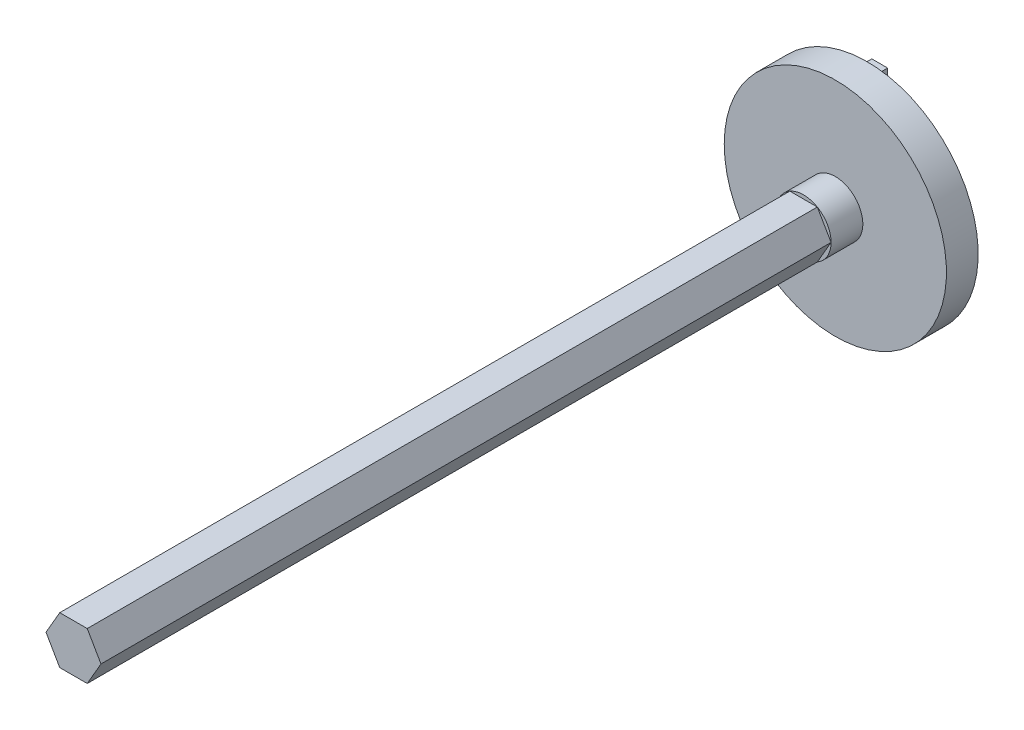
from build123d import *

# Parameters (mm, degrees)
BOSS_EXTRUDE1_DEPTH = 304.8
SKETCH2_R           = 10.998522628
BOSS_EXTRUDE2_DEPTH = 12.7
SKETCH3_R           = 44.45
BOSS_EXTRUDE3_DEPTH = 12.7
SKETCH4_W           = 6.35
SKETCH4_H           = 6.35
BOSS_EXTRUDE4_DEPTH = 5.08


with BuildPart() as part:
    # Sketch1 → Boss-Extrude1 (new body)
    with BuildSketch(Plane.XY):
        Polygon((5.499261314, 9.525), (-5.499261314, 9.525), (-10.998522628, 0), (-5.499261314, -9.525), (5.499261314, -9.525), (10.998522628, 0), align=None)
    extrude(amount=BOSS_EXTRUDE1_DEPTH)

    # Sketch2 → Boss-Extrude2 (add)
    with BuildSketch(Plane(origin=(0, 0, 0), x_dir=(-1, 0, 0), z_dir=(0, 0, -1))):
        Circle(SKETCH2_R)
    extrude(amount=-BOSS_EXTRUDE2_DEPTH)

    # Sketch3 → Boss-Extrude3 (add)
    with BuildSketch(Plane(origin=(0, 0, 0), x_dir=(-1, 0, 0), z_dir=(0, 0, -1))):
        Circle(SKETCH3_R)
    extrude(amount=BOSS_EXTRUDE3_DEPTH)

    # Sketch4 → Boss-Extrude4 (add)
    with BuildSketch(Plane(origin=(0, 0, -12.7), x_dir=(-1, 0, 0), z_dir=(0, 0, -1))):
        with Locations((0, 38.1)):
            Rectangle(SKETCH4_W, SKETCH4_H)
    extrude(amount=BOSS_EXTRUDE4_DEPTH)


solid = part.part
